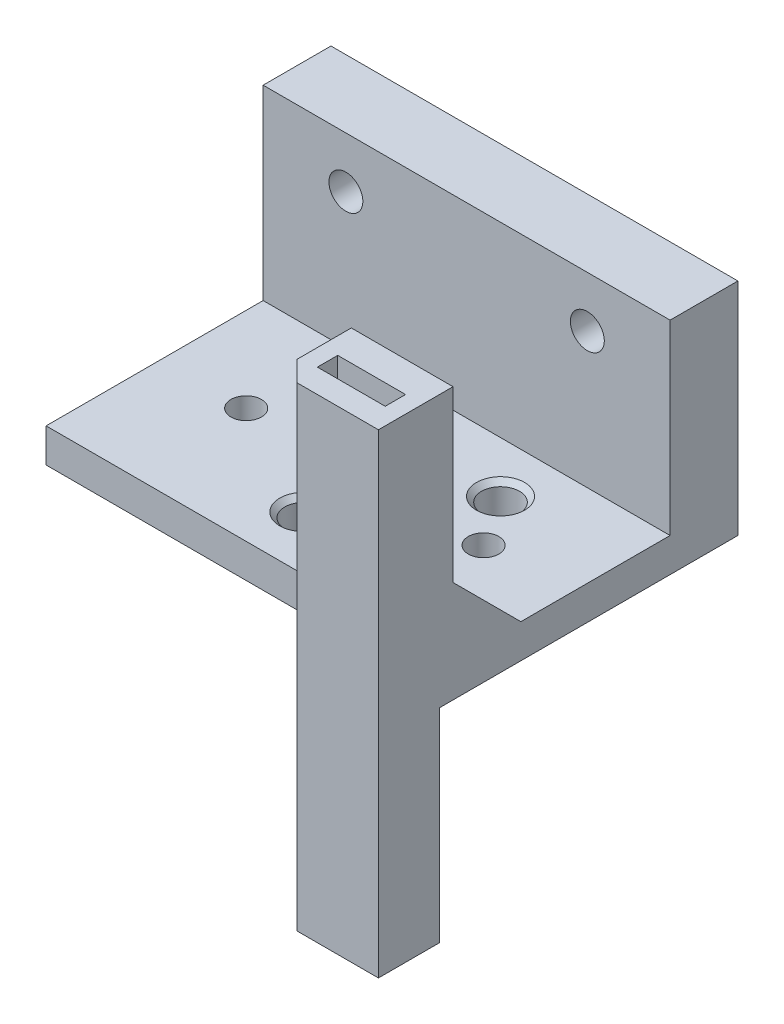
from build123d import *

# Parameters (mm, degrees)
SKETCH1_R                = 2.8
SKETCH1_R_2              = 2.25
BOSS_EXTRUDE1_DEPTH      = 5
SKETCH3_W                = 60
SKETCH3_H                = 10
BOSS_EXTRUDE3_DEPTH      = 27.5
SKETCH4_R                = 2.5
CUT_EXTRUDE1_DEPTH       = 61.993852149
CHAMFER1_SIZE            = 0.75
BOSS_EXTRUDE4_DEPTH      = 30
BOSS_EXTRUDE4_DEPTH_BACK = 40
SKETCH5_W                = 10
SKETCH5_H                = 3
CHAMFER2_SIZE            = 10
CHAMFER3_SIZE            = 5
SKETCH7_W                = 2
SKETCH7_H                = 30
CUT_EXTRUDE2_DEPTH       = 83.462112512
BOSS_EXTRUDE5_DEPTH      = 5
CUT_EXTRUDE3_DEPTH       = 79.89866919
SKETCH10_R               = 2.5
CUT_EXTRUDE4_DEPTH       = 2


with BuildPart() as part:
    # Sketch1 → Boss-Extrude1 (new body)
    with BuildSketch(Plane(origin=(0, 0, 0), x_dir=(1, 0, 0), z_dir=(0, 1, 0))):
        Polygon((-30, 0), (-30, 40), (30, 40), (30, 0), (30, -2), (-30, -2), align=None)
        with Locations(Location((-12.5, 22.5, 0), (0, 0, 270))):
            Circle(SKETCH1_R, mode=Mode.SUBTRACT)
        with Locations(Location((12.5, 22.5, 0), (0, 0, 270))):
            Circle(SKETCH1_R, mode=Mode.SUBTRACT)
        with Locations(Location((-17.5, 15, 0), (0, 0, 270))):
            Circle(SKETCH1_R_2, mode=Mode.SUBTRACT)
        with Locations(Location((17.5, 15, 0), (0, 0, 270))):
            Circle(SKETCH1_R_2, mode=Mode.SUBTRACT)
        with Locations(Location((0, 6, 0), (0, 0, 270))):
            Circle(SKETCH1_R, mode=Mode.SUBTRACT)
    extrude(amount=BOSS_EXTRUDE1_DEPTH)

    # Sketch3 → Boss-Extrude3 (add)
    with BuildSketch(Plane(origin=(0, 5, 0), x_dir=(1, 0, 0), z_dir=(0, 1, 0))):
        with Locations((0, 35)):
            Rectangle(SKETCH3_W, SKETCH3_H)
    extrude(amount=BOSS_EXTRUDE3_DEPTH)

    # Sketch4 → Cut-Extrude1 (cut, through all)
    with BuildSketch(Plane(origin=(0, 0, -40), x_dir=(-1, 0, 0), z_dir=(0, 0, -1))):
        with Locations((-17.8, 25)):
            Circle(SKETCH4_R)
        with Locations((17.8, 25)):
            Circle(SKETCH4_R)
    extrude(amount=-CUT_EXTRUDE1_DEPTH, mode=Mode.SUBTRACT)

    # Chamfer1
    chamfer1_edges = [part.edges().sort_by_distance(p)[0] for p in [
        (-12.5, 5, -25.3),
        (12.5, 5, -25.3),
        (0, 5, -8.8),
    ]]
    chamfer(chamfer1_edges, length=CHAMFER1_SIZE)

    # Sketch5 → Boss-Extrude4 (add, two sides: drawn at the far end of the back side and taken through both)
    with BuildSketch(Plane.XZ.offset(-BOSS_EXTRUDE4_DEPTH_BACK)):
        Polygon((18, 13), (15, 10), (15, 2), (30, 2), (30, 13), align=None)
        with Locations((22.5, 8)):
            Rectangle(SKETCH5_W, SKETCH5_H, mode=Mode.SUBTRACT)
    extrude(amount=BOSS_EXTRUDE4_DEPTH + BOSS_EXTRUDE4_DEPTH_BACK)

    # Chamfer2
    chamfer2_edges = [part.edges().sort_by_distance(p)[0] for p in [
        (22.5, 5, 2),
    ]]
    chamfer(chamfer2_edges, length=CHAMFER2_SIZE)

    # Chamfer3
    chamfer3_edges = [part.edges().sort_by_distance(p)[0] for p in [
        (15, 2.5, 2),
        (15, 5, -3),
    ]]
    chamfer(chamfer3_edges, length=CHAMFER3_SIZE)

    # Sketch7 → Cut-Extrude2 (cut, through all)
    with BuildSketch(Plane(origin=(30, 0, 0), x_dir=(0, 0, -1), z_dir=(1, 0, 0))):
        with Locations((-3, -15)):
            Rectangle(SKETCH7_W, SKETCH7_H)
    extrude(amount=-CUT_EXTRUDE2_DEPTH, mode=Mode.SUBTRACT)

    # Sketch8 → Boss-Extrude5 (add)
    with BuildSketch(Plane(origin=(30, 0, 0), x_dir=(0, 0, -1), z_dir=(1, 0, 0))):
        Polygon((30, 32.5), (-2, 32.5), (-2, 15), (8, 5), (30, 5), align=None)
    extrude(amount=-BOSS_EXTRUDE5_DEPTH)

    # Sketch9 → Cut-Extrude3 (cut, through all)
    with BuildSketch(Plane.ZY.offset(-25)):
        Polygon((-30, 32.5), (-30, 5), (-8, 5), (2, 15), (2, 32.5), align=None)
    extrude(amount=-CUT_EXTRUDE3_DEPTH, mode=Mode.SUBTRACT)

    # Sketch10 → Cut-Extrude4 (cut)
    with BuildSketch(Plane(origin=(0, 0, -40), x_dir=(-1, 0, 0), z_dir=(0, 0, -1))):
        with Locations((0, 25)):
            Circle(SKETCH10_R)
    extrude(amount=-CUT_EXTRUDE4_DEPTH, mode=Mode.SUBTRACT)


solid = part.part
